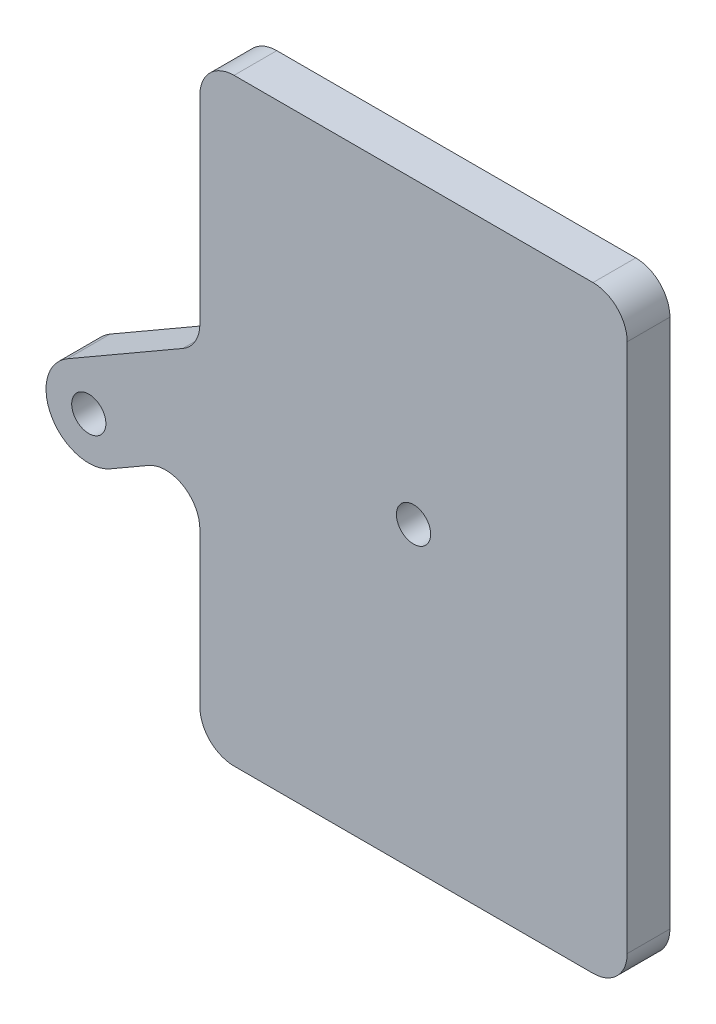
from build123d import *

# Parameters (mm, degrees)
SKETCH_1_R      = 2
EXTRUDE_1_DEPTH = 2.5


with BuildPart() as part:
    # 草圖1 → 填料-伸長1 (new, symmetric)
    with BuildSketch(Plane.XY):
        with BuildLine():
            Line((-21, -35), (21, -35))
            ThreePointArc((21, -35), (23.828427125, -33.828427125), (25, -31))
            Line((25, -31), (25, 31))
            ThreePointArc((25, 31), (23.828427125, 33.828427125), (21, 35))
            Line((21, 35), (-21, 35))
            ThreePointArc((-21, 35), (-23.828427125, 33.828427125), (-25, 31))
            Line((-25, 31), (-25, 7.788457268))
            ThreePointArc((-25, 7.788457268), (-25.535898385, 5.788457268), (-27, 4.324355653))
            Line((-27, 4.324355653), (-40.5, -3.469872981))
            ThreePointArc((-40.5, -3.469872981), (-42.330127019, -10.3), (-35.5, -12.130127019))
            Line((-35.5, -12.130127019), (-31, -9.532050808))
            ThreePointArc((-31, -9.532050808), (-27, -9.532050808), (-25, -12.996152423))
            Line((-25, -12.996152423), (-25, -31))
            ThreePointArc((-25, -31), (-23.828427125, -33.828427125), (-21, -35))
        make_face()
        Circle(SKETCH_1_R, mode=Mode.SUBTRACT)
        with Locations((-38, -7.8)):
            Circle(SKETCH_1_R, mode=Mode.SUBTRACT)
    extrude(amount=EXTRUDE_1_DEPTH, both=True)


solid = part.part
